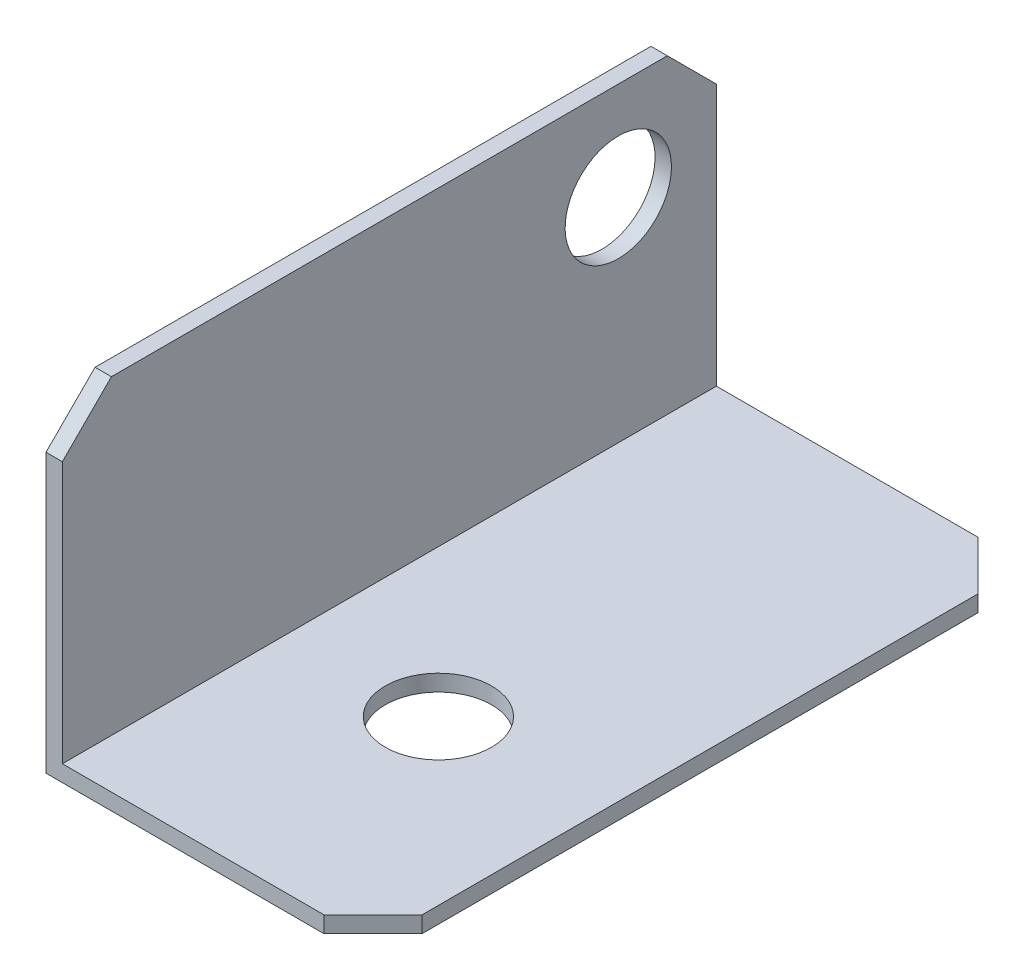
from build123d import *

# Parameters (mm, degrees)
LINEAR_AUSTRAGEN_D_NN1_DEPTH    = 20
FASE1_SIZE                      = 3
SKIZZE2_R                       = 3.25
SCHNITT_LINEAR_AUSTRAGEN1_DEPTH = 10
SKIZZE3_R                       = 3.25
SCHNITT_LINEAR_AUSTRAGEN2_DEPTH = 10


with BuildPart() as part:
    # Skizze1 → Linear-Austragen-Dünn1 (new, symmetric)
    with BuildSketch(Plane.XY):
        Polygon((0, 20), (0, 0), (20, 0), (20, 1), (1, 1), (1, 20), align=None)
    extrude(amount=LINEAR_AUSTRAGEN_D_NN1_DEPTH, both=True)

    # Fase1
    fase1_edges = [part.edges().sort_by_distance(p)[0] for p in [
        (0.5, 20, 20),
        (0.5, 20, -20),
        (20, 0.5, -20),
        (20, 0.5, 20),
    ]]
    chamfer(fase1_edges, length=FASE1_SIZE)

    # Skizze2 → Schnitt-Linear austragen1 (cut)
    with BuildSketch(Plane(origin=(0, 1, 0), x_dir=(1, 0, 0), z_dir=(0, 1, 0))):
        with Locations(Location((10, -6, 0), (0, 0, 270))):
            Circle(SKIZZE2_R)
    extrude(amount=-SCHNITT_LINEAR_AUSTRAGEN1_DEPTH, mode=Mode.SUBTRACT)

    # Skizze3 → Schnitt-Linear austragen2 (cut)
    with BuildSketch(Plane(origin=(1, 0, 0), x_dir=(0, 0, -1), z_dir=(1, 0, 0))):
        with Locations(Location((14, 14, 0), (0, 0, 90))):
            Circle(SKIZZE3_R)
    extrude(amount=-SCHNITT_LINEAR_AUSTRAGEN2_DEPTH, mode=Mode.SUBTRACT)


solid = part.part
